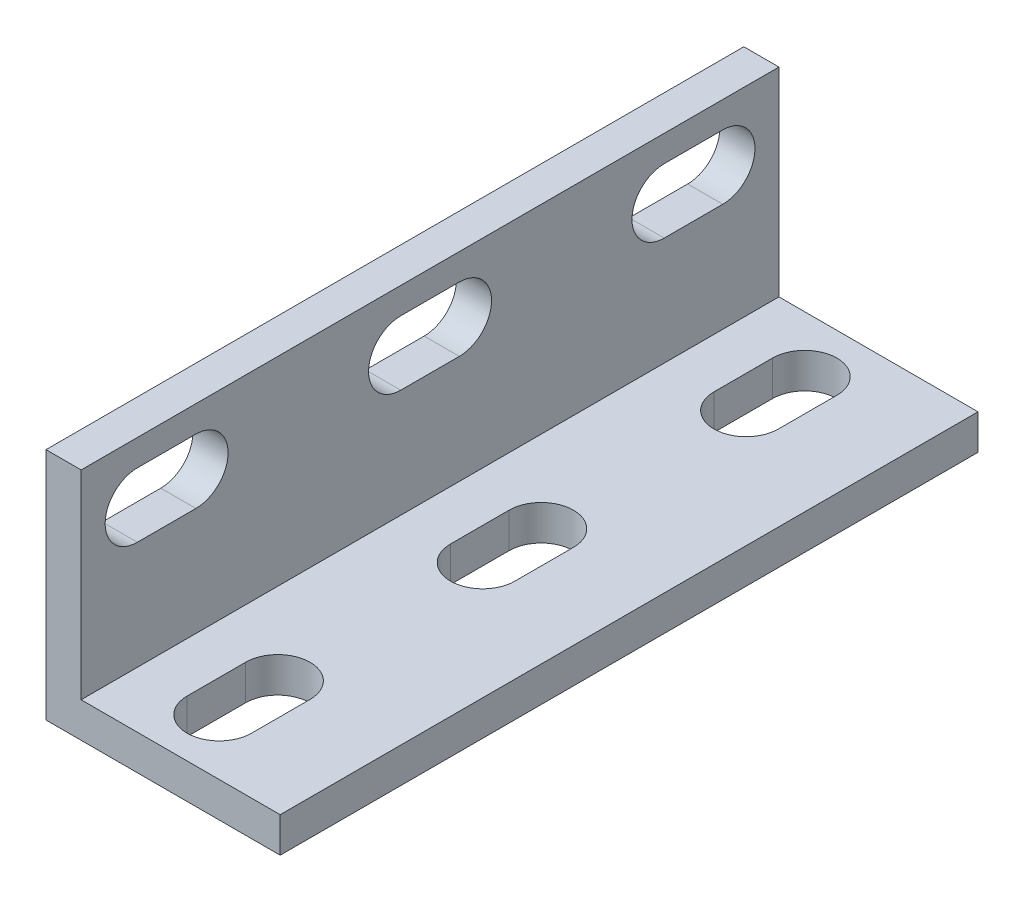
from build123d import *

# Parameters (mm, degrees)
EXTRUDE_THIN1_DEPTH = 59.6
CUT_EXTRUDE1_DEPTH  = 3
CUT_EXTRUDE2_DEPTH  = 3


with BuildPart() as part:
    # Sketch1 → Extrude-Thin1 (new body)
    with BuildSketch(Plane.XY):
        Polygon((0, 20), (0, 0), (20, 0), (20, 3), (3, 3), (3, 20), align=None)
    extrude(amount=EXTRUDE_THIN1_DEPTH)

    # Sketch2 → Cut-Extrude1 (cut)
    with BuildSketch(Plane(origin=(0, 3, 0), x_dir=(1, 0, 0), z_dir=(0, 1, 0))):
        with BuildLine():
            Line((7.25, -54.8), (7.25, -49.8))
            ThreePointArc((7.25, -49.8), (10, -47.05), (12.75, -49.8))
            Line((12.75, -49.8), (12.75, -54.8))
            ThreePointArc((12.75, -54.8), (10, -57.55), (7.25, -54.8))
        make_face()
        with BuildLine():
            Line((12.75, -27.3), (12.75, -32.3))
            ThreePointArc((12.75, -32.3), (10, -35.05), (7.25, -32.3))
            Line((7.25, -32.3), (7.25, -27.3))
            ThreePointArc((7.25, -27.3), (10, -24.55), (12.75, -27.3))
        make_face()
        with BuildLine():
            Line((7.25, -9.8), (7.25, -4.8))
            ThreePointArc((7.25, -4.8), (10, -2.05), (12.75, -4.8))
            Line((12.75, -4.8), (12.75, -9.8))
            ThreePointArc((12.75, -9.8), (10, -12.55), (7.25, -9.8))
        make_face()
    extrude(amount=-CUT_EXTRUDE1_DEPTH, mode=Mode.SUBTRACT)

    # Sketch3 → Cut-Extrude2 (cut)
    with BuildSketch(Plane(origin=(3, 0, 0), x_dir=(0, 0, -1), z_dir=(1, 0, 0))):
        with BuildLine():
            Line((-54.8, 17.75), (-49.8, 17.75))
            ThreePointArc((-49.8, 17.75), (-47.05, 15), (-49.8, 12.25))
            Line((-49.8, 12.25), (-54.8, 12.25))
            ThreePointArc((-54.8, 12.25), (-57.55, 15), (-54.8, 17.75))
        make_face()
        with BuildLine():
            Line((-32.3, 17.75), (-27.3, 17.75))
            ThreePointArc((-27.3, 17.75), (-24.55, 15), (-27.3, 12.25))
            Line((-27.3, 12.25), (-32.3, 12.25))
            ThreePointArc((-32.3, 12.25), (-35.05, 15), (-32.3, 17.75))
        make_face()
        with BuildLine():
            Line((-9.8, 17.75), (-4.8, 17.75))
            ThreePointArc((-4.8, 17.75), (-2.05, 15), (-4.8, 12.25))
            Line((-4.8, 12.25), (-9.8, 12.25))
            ThreePointArc((-9.8, 12.25), (-12.55, 15), (-9.8, 17.75))
        make_face()
    extrude(amount=-CUT_EXTRUDE2_DEPTH, mode=Mode.SUBTRACT)


solid = part.part
